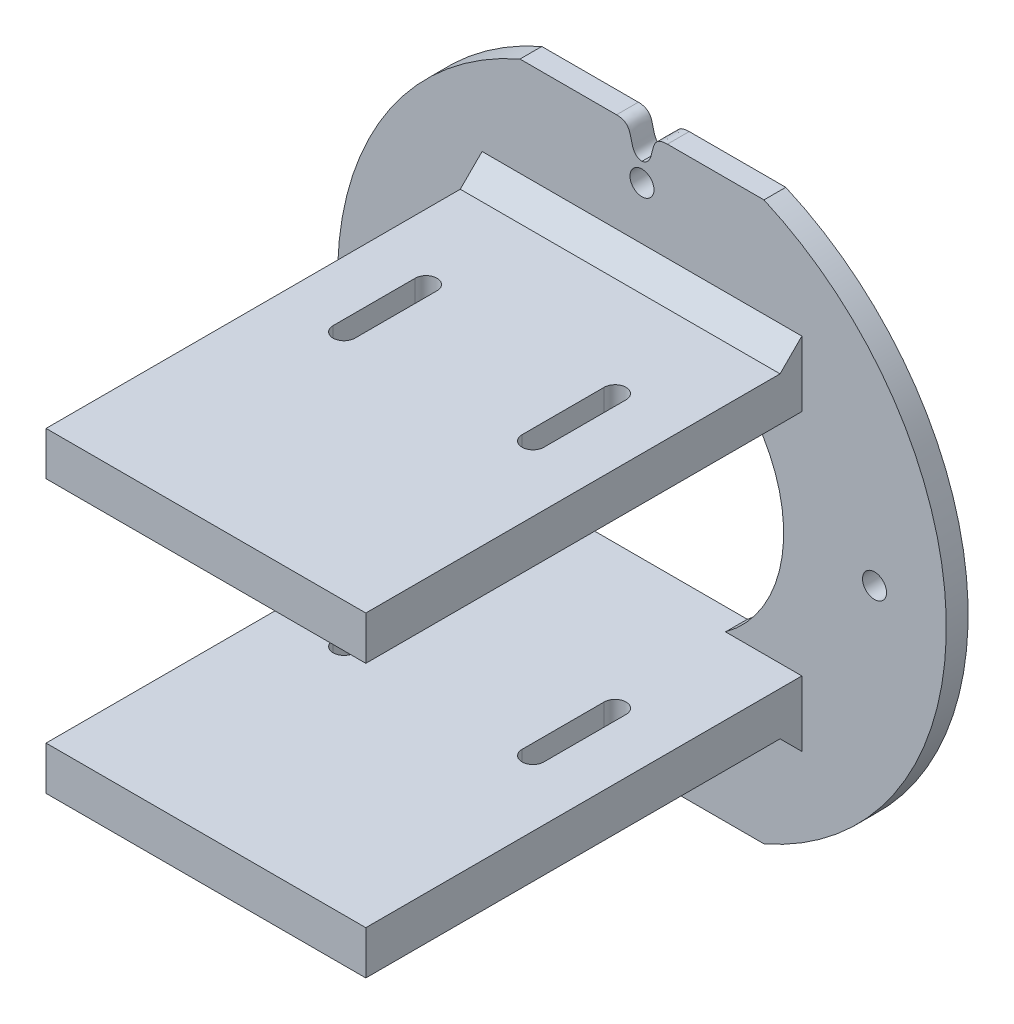
from build123d import *

# Parameters (mm, degrees)
BOSS_EXTRUDE1_DEPTH                   = 3
TAP_DRILL_FOR_M4X0_7_TAP1_D           = 3.3
TAP_DRILL_FOR_M4X0_7_TAP1_CSINK_D     = 3.35
TAP_DRILL_FOR_M4X0_7_TAP1_CSINK_ANGLE = 90
CIRPATTERN1_COUNT                     = 4
SKETCH11_W                            = 60
SKETCH11_H                            = 5.997041234
BOSS_EXTRUDE2_DEPTH                   = 22
CUT_EXTRUDE4_DEPTH                    = 35
CHAMFER1_SIZE                         = 3
CHAMFER2_SIZE                         = 3


with BuildPart() as part:
    # Sketch1 → Boss-Extrude1 (new body)
    with BuildSketch(Plane.XY):
        with BuildLine():
            Line((-16.785410333, -38.37), (-3.5, -38.37))
            add(Edge.make_bspline(
                [(-3.5, -38.37), (-2.487663845, -38.37), (-1.180873463, -37.25254604), (-1.493022396, -34.741636396), (0, -34.57)],
                knots=[0, 0, 0, 0, 0.364574194, 1, 1, 1, 1], degree=3))
            add(Edge.make_bspline(
                [(3.5, -38.37), (2.522461063, -38.37), (1.117320535, -37.441425493), (1.462124558, -34.862224896), (0, -34.57)],
                knots=[0, 0, 0, 0, 0.352042618, 1, 1, 1, 1], degree=3))
            Line((3.5, -38.37), (16.785410333, -38.37))
            ThreePointArc((16.785410333, -38.37), (41.88086556, 0), (16.785410333, 38.37))
            Line((16.785410333, 38.37), (3.5, 38.37))
            add(Edge.make_bspline(
                [(3.5, 38.37), (2.522461063, 38.37), (1.117320535, 37.441425493), (1.462124558, 34.862224896), (0, 34.57)],
                knots=[0, 0, 0, 0, 0.352042618, 1, 1, 1, 1], degree=3))
            add(Edge.make_bspline(
                [(-3.5, 38.37), (-2.487663845, 38.37), (-1.180873463, 37.25254604), (-1.493022396, 34.741636396), (0, 34.57)],
                knots=[0, 0, 0, 0, 0.364574194, 1, 1, 1, 1], degree=3))
            Line((-3.5, 38.37), (-16.785410333, 38.37))
            ThreePointArc((-16.785410333, 38.37), (-41.88086556, 0), (-16.785410333, -38.37))
        make_face()
        with BuildLine():
            Line((11.497282288, -15.75), (-11.497282288, -15.75))
            ThreePointArc((-11.497282288, -15.75), (-19.5, 0), (-11.497282288, 15.75))
            Line((-11.497282288, 15.75), (11.497282288, 15.75))
            ThreePointArc((11.497282288, 15.75), (19.5, 0), (11.497282288, -15.75))
        make_face(mode=Mode.SUBTRACT)
    extrude(amount=BOSS_EXTRUDE1_DEPTH)

    # Tap Drill for M4x0.7 Tap1 (through all)
    with Locations(Plane(origin=(0, 32, 0), x_dir=(-1, 0, 0), z_dir=(0, 0, -1))):
        with Locations((0, 0)):
            tap_drill_for_m4x0_7_tap1 = CounterSinkHole(TAP_DRILL_FOR_M4X0_7_TAP1_D / 2, TAP_DRILL_FOR_M4X0_7_TAP1_CSINK_D / 2, counter_sink_angle=TAP_DRILL_FOR_M4X0_7_TAP1_CSINK_ANGLE)

    # CirPattern1: Tap Drill for M4x0.7 Tap1 ×4 about axis
    cirpattern1_axis = Axis((0, 0, 0), (0, 0, 1))
    for i in range(1, CIRPATTERN1_COUNT):
        add(tap_drill_for_m4x0_7_tap1.rotate(cirpattern1_axis, i * 360 / CIRPATTERN1_COUNT), mode=Mode.SUBTRACT)

    # Sketch11 → Boss-Extrude2 (add, symmetric)
    with BuildSketch(Plane(origin=(0, 0, 0), x_dir=(0, 0, -1), z_dir=(1, 0, 0))):
        with Locations((-33, 18.748520617)):
            Rectangle(SKETCH11_W, SKETCH11_H)
        with Locations((-33, -18.748520617)):
            Rectangle(SKETCH11_W, SKETCH11_H)
    extrude(amount=BOSS_EXTRUDE2_DEPTH, both=True)

    # Sketch9 → Cut-Extrude4 (cut, symmetric)
    with BuildSketch(Plane(origin=(28, 0, 0), x_dir=(0, 0, -1), z_dir=(0, -1, 0))):
        with BuildLine():
            Line((-19.7, -13.5), (-31, -13.5))
            ThreePointArc((-31, -13.5), (-32.5, -15), (-31, -16.5))
            Line((-31, -16.5), (-19.7, -16.5))
            ThreePointArc((-19.7, -16.5), (-18.2, -15), (-19.7, -13.5))
        make_face()
        with BuildLine():
            Line((-19.7, -39.5), (-31, -39.5))
            ThreePointArc((-31, -39.5), (-32.5, -41), (-31, -42.5))
            Line((-31, -42.5), (-19.7, -42.5))
            ThreePointArc((-19.7, -42.5), (-18.2, -41), (-19.7, -39.5))
        make_face()
    extrude(amount=CUT_EXTRUDE4_DEPTH, both=True, mode=Mode.SUBTRACT)

    # Chamfer1
    chamfer1_edges = [part.edges().sort_by_distance(p)[0] for p in [
        (0, 21.747041234, 3),
    ]]
    chamfer(chamfer1_edges, length=CHAMFER1_SIZE)

    # Chamfer2
    chamfer2_edges = [part.edges().sort_by_distance(p)[0] for p in [
        (0, -21.747041234, 3),
    ]]
    chamfer(chamfer2_edges, length=CHAMFER2_SIZE)


solid = part.part
